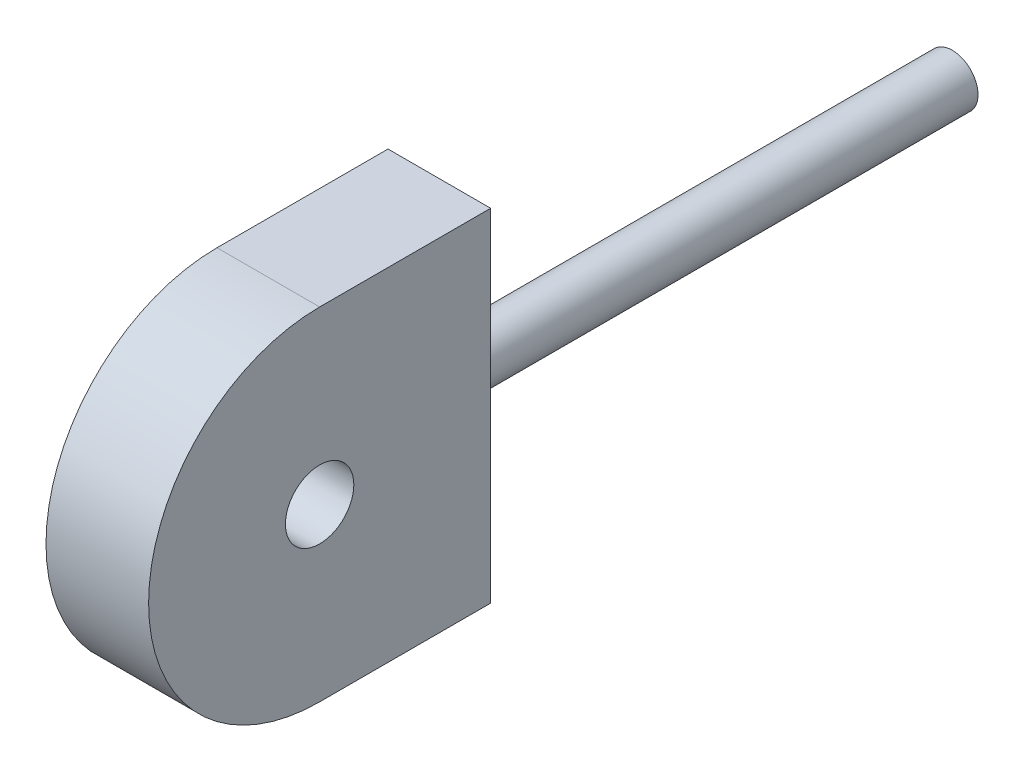
from build123d import *

# Parameters (mm, degrees)
EXTRUDE_2_DEPTH      = 3
EXTRUDE_2_DEPTH_BACK = 3
SKETCH_1_R           = 2
SKETCH_2_R           = 1.5
EXTRUDE_3_DEPTH      = 30


with BuildPart() as part:
    # 草图1 → 凸台-拉伸2 (new, two sides: drawn at the far end of the back side and taken through both)
    with BuildSketch(Plane(origin=(0, 0, 0), x_dir=(0, 0, -1), z_dir=(1, 0, 0)).offset(-EXTRUDE_2_DEPTH_BACK)):
        with BuildLine():
            Line((10, 10), (0, 10))
            ThreePointArc((0, 10), (-10, 0), (0, -10))
            Line((0, -10), (10, -10))
            Line((10, -10), (10, 10))
        make_face()
        Circle(SKETCH_1_R, mode=Mode.SUBTRACT)
    extrude(amount=EXTRUDE_2_DEPTH + EXTRUDE_2_DEPTH_BACK)

    # 草图2 → 凸台-拉伸3 (add)
    with BuildSketch(Plane(origin=(0, 0, -10), x_dir=(-1, 0, 0), z_dir=(0, 0, -1))):
        Circle(SKETCH_2_R)
    extrude(amount=EXTRUDE_3_DEPTH)


solid = part.part
